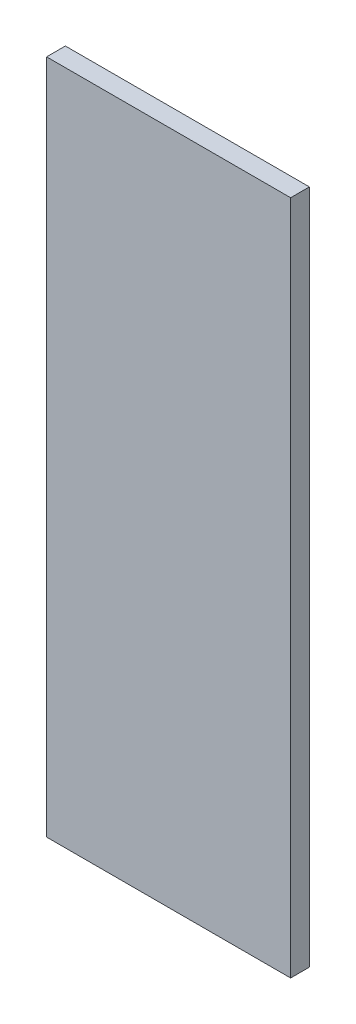
from build123d import *

# Parameters (mm, degrees)
SKETCH1_W           = 165.1
SKETCH1_H           = 457.2
BOSS_EXTRUDE1_DEPTH = 12.7


with BuildPart() as part:
    # Sketch1 → Boss-Extrude1 (new body)
    with BuildSketch(Plane.XY):
        with Locations((-227.090807175, -41.517040359)):
            Rectangle(SKETCH1_W, SKETCH1_H)
    extrude(amount=BOSS_EXTRUDE1_DEPTH)


solid = part.part
